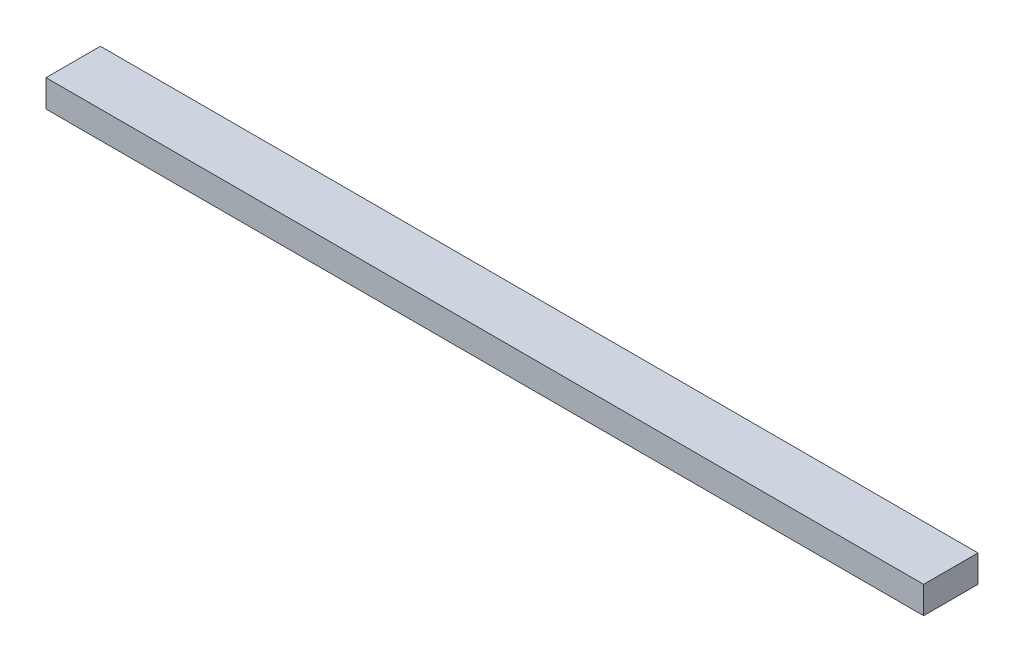
from build123d import *

# Parameters (mm, degrees)
ESQUISSE1_W        = 710
ESQUISSE1_H        = 22
BOSS_EXTRU_1_DEPTH = 44


with BuildPart() as part:
    # Esquisse1 → Boss.-Extru.1 (new body)
    with BuildSketch(Plane.XY):
        with Locations((0, -11)):
            Rectangle(ESQUISSE1_W, ESQUISSE1_H)
    extrude(amount=BOSS_EXTRU_1_DEPTH)


solid = part.part
